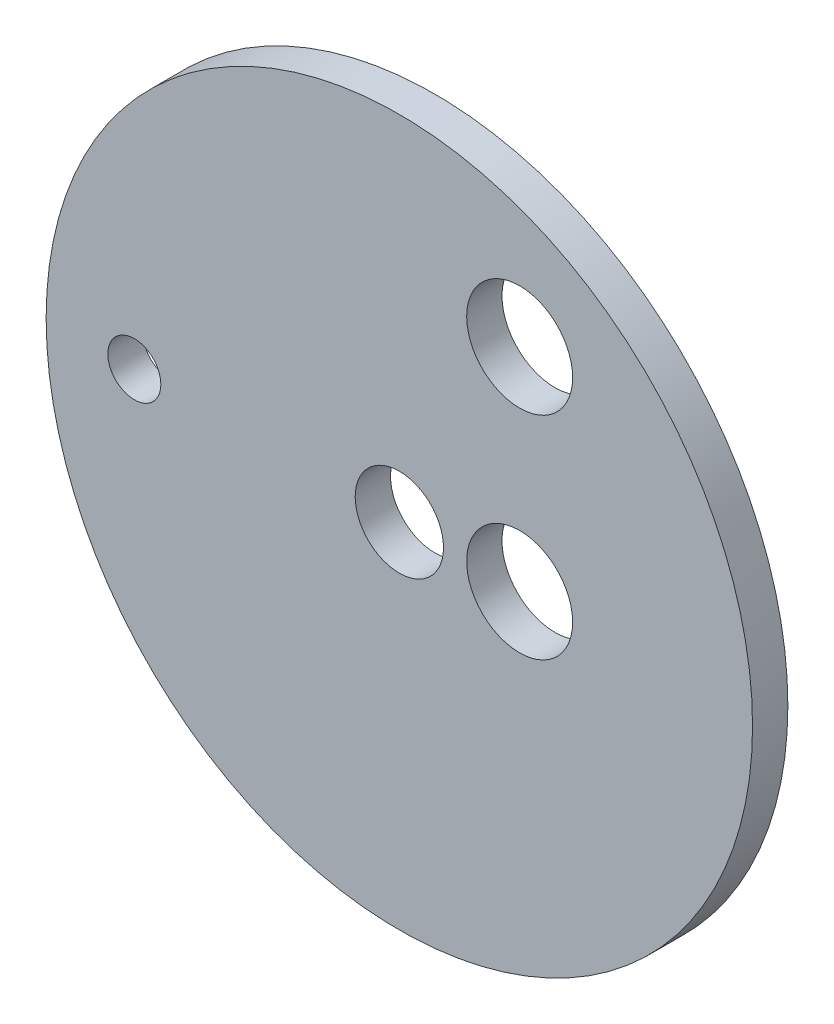
from build123d import *

# Parameters (mm, degrees)
SKETCH1_R           = 100
BOSS_EXTRUDE1_DEPTH = 10
SKETCH3_R           = 12.5
CUT_EXTRUDE2_DEPTH  = 20
SKETCH2_R           = 7.5
CUT_EXTRUDE3_DEPTH  = 10
SKETCH5_R           = 15
CUT_EXTRUDE5_DEPTH  = 10
BOSS_EXTRUDE2_START = -10
SKETCH6_R           = 15
BOSS_EXTRUDE2_DEPTH = 10
SKETCH7_R           = 15
CUT_EXTRUDE6_DEPTH  = 30


with BuildPart() as part:
    # Sketch1 → Boss-Extrude1 (new body)
    with BuildSketch(Plane.XY):
        Circle(SKETCH1_R)
    extrude(amount=BOSS_EXTRUDE1_DEPTH)

    # Sketch3 → Cut-Extrude2 (cut)
    with BuildSketch(Plane(origin=(0, 0, 0), x_dir=(-1, 0, 0), z_dir=(0, 0, -1))):
        Circle(SKETCH3_R)
    extrude(amount=-CUT_EXTRUDE2_DEPTH, mode=Mode.SUBTRACT)

    # Sketch2 → Cut-Extrude3 (cut)
    with BuildSketch(Plane.XY.offset(10)):
        with Locations((-75.027755171, 0)):
            Circle(SKETCH2_R)
    extrude(amount=-CUT_EXTRUDE3_DEPTH, mode=Mode.SUBTRACT)

    # Sketch5 → Cut-Extrude5 (cut)
    with BuildSketch(Plane.XY.offset(10)):
        with Locations((34.061352159, 0)):
            Circle(SKETCH5_R)
        with Locations((79.061352159, 0)):
            Circle(SKETCH5_R)
    extrude(amount=-CUT_EXTRUDE5_DEPTH, mode=Mode.SUBTRACT)

    # Sketch6 → Boss-Extrude2 (add)
    with BuildSketch(Plane(origin=(0, 0, 0), x_dir=(-1, 0, 0), z_dir=(0, 0, -1)).offset(BOSS_EXTRUDE2_START)):
        with Locations((-79.061352159, 0)):
            Circle(SKETCH6_R)
    extrude(amount=BOSS_EXTRUDE2_DEPTH)

    # Sketch7 → Cut-Extrude6 (cut)
    with BuildSketch(Plane(origin=(0, 0, 0), x_dir=(-1, 0, 0), z_dir=(0, 0, -1))):
        with Locations((-34.061352159, 60)):
            Circle(SKETCH7_R)
    extrude(amount=-CUT_EXTRUDE6_DEPTH, mode=Mode.SUBTRACT)


solid = part.part
